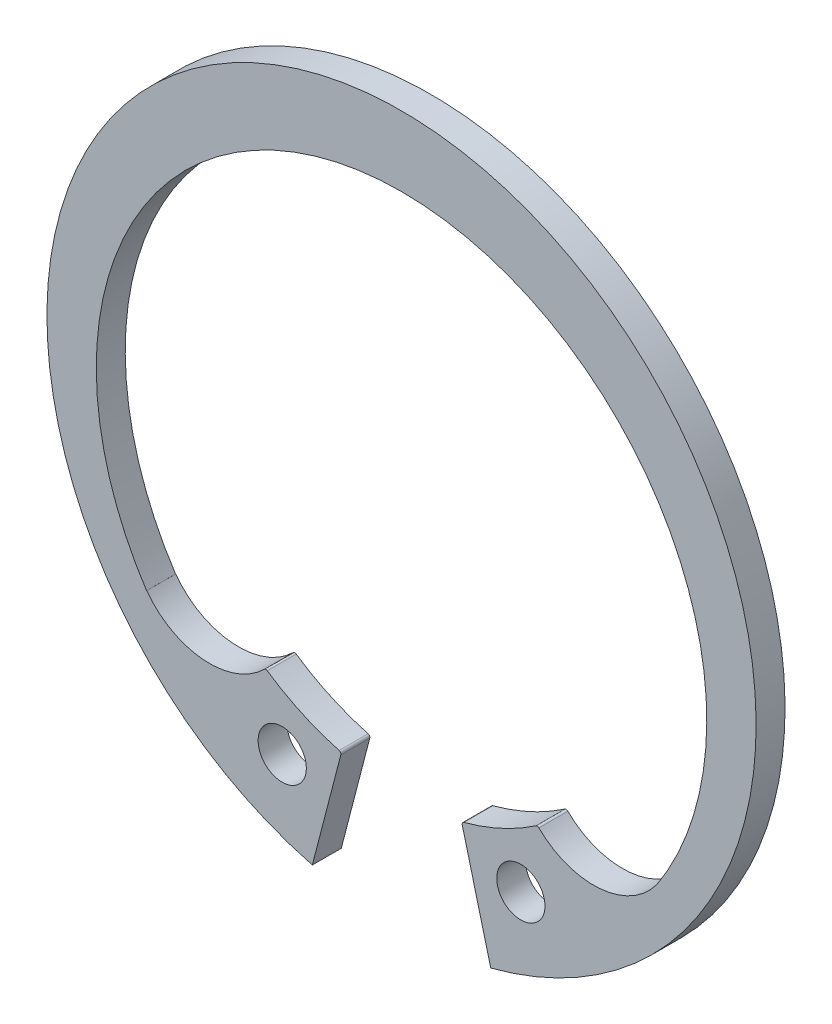
from build123d import *

# Parameters (mm, degrees)
BODYSKE_R    = 1
BODY_DEPTH   = 1.2
MODLUGSKE_R  = 1
MODLUG_DEPTH = 1.2


with BuildPart() as part:
    # BodySke → Body (new body)
    with BuildSketch(Plane.XY):
        with BuildLine():
            Line((3.698325427, -14.227170802), (2.961893262, -11.394173437))
            ThreePointArc((2.961893262, -11.394173437), (3.929191569, -9.098338228), (6.398111495, -9.431444396))
            ThreePointArc((6.398111495, -9.431444396), (7.897695705, -10.033919527), (9.36780531, -9.362721467))
            ThreePointArc((9.36780531, -9.362721467), (0, 11.8), (-9.36780531, -9.362721467))
            ThreePointArc((-9.36780531, -9.362721467), (-7.897695705, -10.033919527), (-6.398111495, -9.431444396))
            ThreePointArc((-6.398111495, -9.431444396), (-3.929191569, -9.098338228), (-2.961893262, -11.394173437))
            Line((-2.961893262, -11.394173437), (-3.698325427, -14.227170802))
            ThreePointArc((-3.698325427, -14.227170802), (0, 14.7), (3.698325427, -14.227170802))
        make_face()
        with Locations((4.945954497, -10.878420571)):
            Circle(BODYSKE_R, mode=Mode.SUBTRACT)
        with Locations((-4.945954497, -10.878420571)):
            Circle(BODYSKE_R, mode=Mode.SUBTRACT)
    extrude(amount=-BODY_DEPTH)

    # ModLugSke → ModLug (add, through all)
    # profile 1 of 2: a face of its own
    with BuildSketch(Plane.XY):
        with BuildLine():
            Line((3.698325427, -14.227170802), (2.515741841, -9.677863555))
            ThreePointArc((2.515741841, -9.677863555), (2.526047037, -9.602490267), (2.586400063, -9.55617783))
            ThreePointArc((2.586400063, -9.55617783), (4.133747796, -8.995672802), (5.566861748, -8.186577446))
            ThreePointArc((5.566861748, -8.186577446), (5.632003549, -8.169667957), (5.693109271, -8.197872134))
            ThreePointArc((5.693109271, -8.197872134), (8.216340211, -9.113789007), (10.56344638, -7.811218195))
            Line((10.56344638, -7.811218195), (11.81954198, -8.740047333))
            ThreePointArc((11.81954198, -8.740047333), (8.229713434, -12.180386562), (3.698325427, -14.227170802))
        make_face()
        with Locations((4.945954497, -10.878420571)):
            Circle(MODLUGSKE_R, mode=Mode.SUBTRACT)
    # profile 2 of 2: a face of its own
    with BuildSketch(Plane.XY):
        with BuildLine():
            Line((-3.698325427, -14.227170802), (-2.515741841, -9.677863555))
            ThreePointArc((-2.515741841, -9.677863555), (-2.526047037, -9.602490267), (-2.586400063, -9.55617783))
            ThreePointArc((-2.586400063, -9.55617783), (-4.133747796, -8.995672802), (-5.566861748, -8.186577446))
            ThreePointArc((-5.566861748, -8.186577446), (-5.632003549, -8.169667957), (-5.693109271, -8.197872134))
            ThreePointArc((-5.693109271, -8.197872134), (-8.216340211, -9.113789007), (-10.56344638, -7.811218195))
            Line((-10.56344638, -7.811218195), (-11.81954198, -8.740047333))
            ThreePointArc((-11.81954198, -8.740047333), (-8.229713434, -12.180386562), (-3.698325427, -14.227170802))
        make_face()
        with Locations((-4.945954497, -10.878420571)):
            Circle(MODLUGSKE_R, mode=Mode.SUBTRACT)
    extrude(amount=-MODLUG_DEPTH)


solid = part.part
